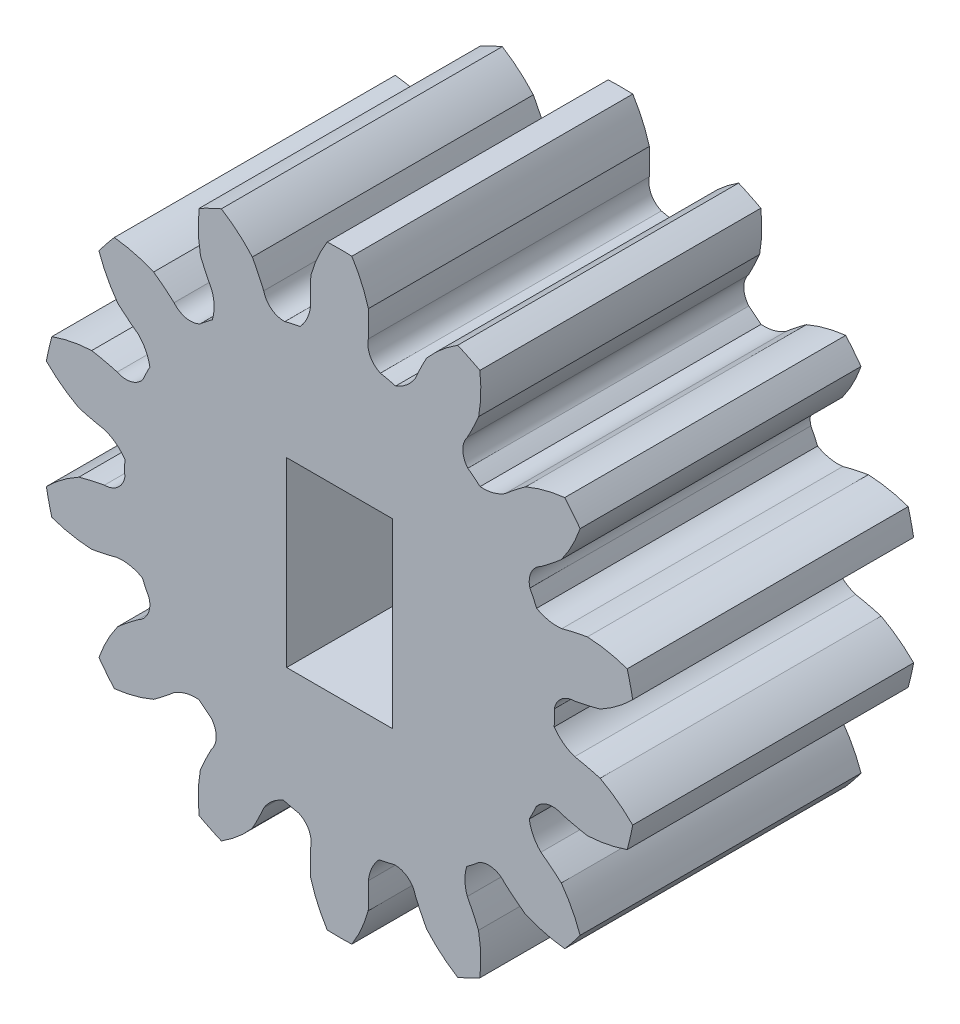
from build123d import *

# Parameters (mm, degrees)
BOSS_EXTRUDE1_DEPTH    = 8.5
BOSS_EXTRUDE1_2_DEPTH  = 8.5
BOSS_EXTRUDE1_3_DEPTH  = 8.5
BOSS_EXTRUDE1_4_DEPTH  = 8.5
BOSS_EXTRUDE1_5_DEPTH  = 8.5
BOSS_EXTRUDE1_6_DEPTH  = 8.5
BOSS_EXTRUDE1_7_DEPTH  = 8.5
BOSS_EXTRUDE1_8_DEPTH  = 8.5
BOSS_EXTRUDE1_9_DEPTH  = 8.5
BOSS_EXTRUDE1_10_DEPTH = 8.5
BOSS_EXTRUDE1_11_DEPTH = 8.5
BOSS_EXTRUDE1_12_DEPTH = 8.5
BOSS_EXTRUDE1_13_DEPTH = 8.5
BOSS_EXTRUDE1_14_DEPTH = 8.5
SKETCH1_R              = 6.5
BOSS_EXTRUDE2_DEPTH    = 8.5
SKETCH3_W              = 3.2
SKETCH3_H              = 5.5
CUT_EXTRUDE1_DEPTH     = 6


with BuildPart() as part:
    # Sketch2 → Boss-Extrude1 (new body)
    with BuildSketch(Plane.XY.offset(20)):
        with BuildLine():
            ThreePointArc((-0.372442837, 29.93778576), (0, 29.945381287), (0.372442837, 29.93778576))
            ThreePointArc((0.372442837, 29.93778576), (0.664207711, 29.394961978), (0.87300932, 28.815146242))
            ThreePointArc((0.87300932, 28.815146242), (0.882118298, 28.419135302), (0.87300932, 28.023124361))
            ThreePointArc((0.87300932, 28.023124361), (0.925832605, 27.599473266), (1.236429032, 27.306556197))
            ThreePointArc((1.236429032, 27.306556197), (0.022155909, 27.42519857), (-1.192897802, 27.314836852))
            ThreePointArc((-1.192897802, 27.314836852), (-0.97608072, 27.643294757), (-0.87300932, 28.023124361))
            ThreePointArc((-0.87300932, 28.023124361), (-0.8804421, 28.419198634), (-0.867969423, 28.815146242))
            ThreePointArc((-0.867969423, 28.815146242), (-0.661618034, 29.394744976), (-0.372442837, 29.93778576))
        make_face()
    extrude(amount=BOSS_EXTRUDE1_DEPTH)



with BuildPart() as body_2:
    # Sketch2 → Boss-Extrude1 2 (new body)
    with BuildSketch(Plane.XY.offset(20)):
        with BuildLine():
            ThreePointArc((1.697579984, 27.199646438), (2.840189705, 26.771886862), (3.882734989, 26.138140415))
            ThreePointArc((3.882734989, 26.138140415), (3.729989232, 26.536812314), (3.866212417, 26.941427926))
            ThreePointArc((3.866212417, 26.941427926), (4.04624203, 27.294269217), (4.209857833, 27.655014984))
            ThreePointArc((4.209857833, 27.655014984), (4.273306703, 28.268006533), (4.245958047, 28.883665896))
            ThreePointArc((4.245958047, 28.883665896), (3.913694222, 29.052106121), (3.574839244, 29.206859677))
            ThreePointArc((3.574839244, 29.206859677), (3.078684828, 28.843065253), (2.641290186, 28.41039735))
            ThreePointArc((2.641290186, 28.41039735), (2.458257463, 28.059072574), (2.29310398, 27.698997022))
            ThreePointArc((2.29310398, 27.698997022), (2.035437968, 27.401503378), (1.697579984, 27.199646438))
        make_face()
    extrude(amount=BOSS_EXTRUDE1_2_DEPTH)


with BuildPart() as body_3:
    # Sketch2 → Boss-Extrude1 3 (new body)
    with BuildSketch(Plane.XY.offset(20)):
        with BuildLine():
            ThreePointArc((4.251831235, 25.84173215), (5.095689097, 24.960574312), (5.760017664, 23.937245047))
            ThreePointArc((5.760017664, 23.937245047), (5.795375746, 24.362709917), (6.093664729, 24.668150961))
            ThreePointArc((6.093664729, 24.668150961), (6.408957905, 24.907938059), (6.712892371, 25.161968527))
            ThreePointArc((6.712892371, 25.161968527), (7.036024894, 25.686725397), (7.278509192, 26.253281452))
            ThreePointArc((7.278509192, 26.253281452), (7.052233304, 26.549204722), (6.81408057, 26.835656524))
            ThreePointArc((6.81408057, 26.835656524), (6.209216403, 26.723162406), (5.62740988, 26.523120518))
            ThreePointArc((5.62740988, 26.523120518), (5.310068987, 26.286002754), (5.005039914, 26.033243303))
            ThreePointArc((5.005039914, 26.033243303), (4.643813204, 25.877007884), (4.251831235, 25.84173215))
        make_face()
    extrude(amount=BOSS_EXTRUDE1_3_DEPTH)


with BuildPart() as body_4:
    # Sketch2 → Boss-Extrude1 4 (new body)
    with BuildSketch(Plane.XY.offset(20)):
        with BuildLine():
            ThreePointArc((5.963955164, 23.510045569), (6.341924769, 22.350013584), (6.496458198, 21.139784413))
            ThreePointArc((6.496458198, 21.139784413), (6.712917018, 21.507773718), (7.114192008, 21.65354385))
            ThreePointArc((7.114192008, 21.65354385), (7.502301066, 21.732783978), (7.886356247, 21.829785299))
            ThreePointArc((7.886356247, 21.829785299), (8.405172063, 22.162372954), (8.869462327, 22.567612329))
            ThreePointArc((8.869462327, 22.567612329), (8.793991091, 22.93240741), (8.703709671, 23.293822164))
            ThreePointArc((8.703709671, 23.293822164), (8.109936518, 23.454909193), (7.498952032, 23.52711407))
            ThreePointArc((7.498952032, 23.52711407), (7.110156225, 23.451167399), (6.725666309, 23.355786157))
            ThreePointArc((6.725666309, 23.355786157), (6.332424282, 23.371753304), (5.963955164, 23.510045569))
        make_face()
    extrude(amount=BOSS_EXTRUDE1_4_DEPTH)


with BuildPart() as body_5:
    # Sketch2 → Boss-Extrude1 5 (new body)
    with BuildSketch(Plane.XY.offset(20)):
        with BuildLine():
            ThreePointArc((6.49484463, 20.666405817), (6.332064462, 19.457258248), (5.946195512, 18.299829899))
            ThreePointArc((5.946195512, 18.299829899), (6.300882746, 18.537458845), (6.725666309, 18.494686503))
            ThreePointArc((6.725666309, 18.494686503), (7.109721491, 18.397685182), (7.497830549, 18.318445054))
            ThreePointArc((7.497830549, 18.318445054), (8.109571823, 18.392990431), (8.703709671, 18.556650496))
            ThreePointArc((8.703709671, 18.556650496), (8.793991091, 18.91806525), (8.869462327, 19.282860332))
            ThreePointArc((8.869462327, 19.282860332), (8.404384244, 19.685623245), (7.885234765, 20.015773825))
            ThreePointArc((7.885234765, 20.015773825), (7.501989821, 20.116040417), (7.114192008, 20.19692881))
            ThreePointArc((7.114192008, 20.19692881), (6.766821069, 20.381936033), (6.49484463, 20.666405817))
        make_face()
    extrude(amount=BOSS_EXTRUDE1_5_DEPTH)


with BuildPart() as body_6:
    # Sketch2 → Boss-Extrude1 6 (new body)
    with BuildSketch(Plane.XY.offset(20)):
        with BuildLine():
            ThreePointArc((5.739350463, 17.874030623), (5.06806113, 16.855253974), (4.21821588, 15.979869328))
            ThreePointArc((4.21821588, 15.979869328), (4.640881371, 16.040072587), (5.005039914, 15.817229357))
            ThreePointArc((5.005039914, 15.817229357), (5.30897438, 15.563198889), (5.624267555, 15.323411791))
            ThreePointArc((5.624267555, 15.323411791), (6.207771425, 15.125150264), (6.81408057, 15.014816136))
            ThreePointArc((6.81408057, 15.014816136), (7.052233304, 15.301267938), (7.278509192, 15.597191208))
            ThreePointArc((7.278509192, 15.597191208), (7.034240598, 16.161857871), (6.709750047, 16.684563783))
            ThreePointArc((6.709750047, 16.684563783), (6.407962328, 16.94118461), (6.093664729, 17.182321699))
            ThreePointArc((6.093664729, 17.182321699), (5.860965954, 17.499726049), (5.739350463, 17.874030623))
        make_face()
    extrude(amount=BOSS_EXTRUDE1_6_DEPTH)


with BuildPart() as body_7:
    # Sketch2 → Boss-Extrude1 7 (new body)
    with BuildSketch(Plane.XY.offset(20)):
        with BuildLine():
            ThreePointArc((3.847107548, 15.68598414), (2.800266136, 15.059359621), (1.65476686, 14.639399342))
            ThreePointArc((1.65476686, 14.639399342), (2.061696523, 14.510252921), (2.29310398, 14.151475639))
            ThreePointArc((2.29310398, 14.151475639), (2.456719782, 13.790729872), (2.636749396, 13.43788858))
            ThreePointArc((2.636749396, 13.43788858), (3.076445764, 13.006088276), (3.574839244, 12.643612983))
            ThreePointArc((3.574839244, 12.643612983), (3.913694222, 12.798366539), (4.245958047, 12.966806765))
            ThreePointArc((4.245958047, 12.966806765), (4.270879331, 13.58153802), (4.205317042, 14.193270947))
            ThreePointArc((4.205317042, 14.193270947), (4.044759307, 14.555419107), (3.866212417, 14.909044735))
            ThreePointArc((3.866212417, 14.909044735), (3.794274651, 15.295980387), (3.847107548, 15.68598414))
        make_face()
    extrude(amount=BOSS_EXTRUDE1_7_DEPTH)


with BuildPart() as body_8:
    # Sketch2 → Boss-Extrude1 8 (new body)
    with BuildSketch(Plane.XY.offset(20)):
        with BuildLine():
            ThreePointArc((1.192897802, 14.535635808), (-0.022155909, 14.425274091), (-1.236429032, 14.543916463))
            ThreePointArc((-1.236429032, 14.543916463), (-0.925832605, 14.250999394), (-0.87300932, 13.827348299))
            ThreePointArc((-0.87300932, 13.827348299), (-0.882118298, 13.431337359), (-0.87300932, 13.035326418))
            ThreePointArc((-0.87300932, 13.035326418), (-0.664207711, 12.455510682), (-0.372442837, 11.912686901))
            ThreePointArc((-0.372442837, 11.912686901), (0, 11.905091373), (0.372442837, 11.912686901))
            ThreePointArc((0.372442837, 11.912686901), (0.661618034, 12.455727684), (0.867969423, 13.035326418))
            ThreePointArc((0.867969423, 13.035326418), (0.8804421, 13.431274026), (0.87300932, 13.827348299))
            ThreePointArc((0.87300932, 13.827348299), (0.97608072, 14.207177903), (1.192897802, 14.535635808))
        make_face()
    extrude(amount=BOSS_EXTRUDE1_8_DEPTH)


with BuildPart() as body_9:
    # Sketch2 → Boss-Extrude1 9 (new body)
    with BuildSketch(Plane.XY.offset(20)):
        with BuildLine():
            ThreePointArc((-1.697579984, 14.650826223), (-2.840189705, 15.078585798), (-3.882734989, 15.712332245))
            ThreePointArc((-3.882734989, 15.712332245), (-3.729989232, 15.313660346), (-3.866212417, 14.909044735))
            ThreePointArc((-3.866212417, 14.909044735), (-4.04624203, 14.556203443), (-4.209857833, 14.195457676))
            ThreePointArc((-4.209857833, 14.195457676), (-4.273306703, 13.582466127), (-4.245958047, 12.966806765))
            ThreePointArc((-4.245958047, 12.966806765), (-3.913694222, 12.798366539), (-3.574839244, 12.643612983))
            ThreePointArc((-3.574839244, 12.643612983), (-3.078684828, 13.007407407), (-2.641290186, 13.44007531))
            ThreePointArc((-2.641290186, 13.44007531), (-2.458257463, 13.791400086), (-2.29310398, 14.151475639))
            ThreePointArc((-2.29310398, 14.151475639), (-2.035437968, 14.448969282), (-1.697579984, 14.650826223))
        make_face()
    extrude(amount=BOSS_EXTRUDE1_9_DEPTH)


with BuildPart() as body_10:
    # Sketch2 → Boss-Extrude1 10 (new body)
    with BuildSketch(Plane.XY.offset(20)):
        with BuildLine():
            ThreePointArc((-4.251831235, 16.00874051), (-5.095689097, 16.889898348), (-5.760017664, 17.913227613))
            ThreePointArc((-5.760017664, 17.913227613), (-5.795375746, 17.487762743), (-6.093664729, 17.182321699))
            ThreePointArc((-6.093664729, 17.182321699), (-6.408957905, 16.942534602), (-6.712892371, 16.688504133))
            ThreePointArc((-6.712892371, 16.688504133), (-7.036024894, 16.163747263), (-7.278509192, 15.597191208))
            ThreePointArc((-7.278509192, 15.597191208), (-7.052233304, 15.301267938), (-6.81408057, 15.014816136))
            ThreePointArc((-6.81408057, 15.014816136), (-6.209216403, 15.127310254), (-5.62740988, 15.327352142))
            ThreePointArc((-5.62740988, 15.327352142), (-5.310068987, 15.564469906), (-5.005039914, 15.817229357))
            ThreePointArc((-5.005039914, 15.817229357), (-4.643813204, 15.973464776), (-4.251831235, 16.00874051))
        make_face()
    extrude(amount=BOSS_EXTRUDE1_10_DEPTH)


with BuildPart() as body_11:
    # Sketch2 → Boss-Extrude1 11 (new body)
    with BuildSketch(Plane.XY.offset(20)):
        with BuildLine():
            ThreePointArc((-5.963955164, 18.340427091), (-6.341924769, 19.500459076), (-6.496458198, 20.710688248))
            ThreePointArc((-6.496458198, 20.710688248), (-6.712917018, 20.342698943), (-7.114192008, 20.19692881))
            ThreePointArc((-7.114192008, 20.19692881), (-7.502301066, 20.117688682), (-7.886356247, 20.020687361))
            ThreePointArc((-7.886356247, 20.020687361), (-8.405172063, 19.688099706), (-8.869462327, 19.282860332))
            ThreePointArc((-8.869462327, 19.282860332), (-8.793991091, 18.91806525), (-8.703709671, 18.556650496))
            ThreePointArc((-8.703709671, 18.556650496), (-8.109936518, 18.395563467), (-7.498952032, 18.323358591))
            ThreePointArc((-7.498952032, 18.323358591), (-7.110156225, 18.399305261), (-6.725666309, 18.494686503))
            ThreePointArc((-6.725666309, 18.494686503), (-6.332424282, 18.478719356), (-5.963955164, 18.340427091))
        make_face()
    extrude(amount=BOSS_EXTRUDE1_11_DEPTH)


with BuildPart() as body_12:
    # Sketch2 → Boss-Extrude1 12 (new body)
    with BuildSketch(Plane.XY.offset(20)):
        with BuildLine():
            ThreePointArc((-6.49484463, 21.184066843), (-6.332064462, 22.393214413), (-5.946195512, 23.550642761))
            ThreePointArc((-5.946195512, 23.550642761), (-6.300882746, 23.313013816), (-6.725666309, 23.355786157))
            ThreePointArc((-6.725666309, 23.355786157), (-7.109721491, 23.452787479), (-7.497830549, 23.532027606))
            ThreePointArc((-7.497830549, 23.532027606), (-8.109571823, 23.457482229), (-8.703709671, 23.293822164))
            ThreePointArc((-8.703709671, 23.293822164), (-8.793991091, 22.93240741), (-8.869462327, 22.567612329))
            ThreePointArc((-8.869462327, 22.567612329), (-8.404384244, 22.164849415), (-7.885234765, 21.834698836))
            ThreePointArc((-7.885234765, 21.834698836), (-7.501989821, 21.734432243), (-7.114192008, 21.65354385))
            ThreePointArc((-7.114192008, 21.65354385), (-6.766821069, 21.468536627), (-6.49484463, 21.184066843))
        make_face()
    extrude(amount=BOSS_EXTRUDE1_12_DEPTH)


with BuildPart() as body_13:
    # Sketch2 → Boss-Extrude1 13 (new body)
    with BuildSketch(Plane.XY.offset(20)):
        with BuildLine():
            ThreePointArc((-5.739350463, 23.976442037), (-5.06806113, 24.995218686), (-4.21821588, 25.870603333))
            ThreePointArc((-4.21821588, 25.870603333), (-4.640881371, 25.810400073), (-5.005039914, 26.033243303))
            ThreePointArc((-5.005039914, 26.033243303), (-5.30897438, 26.287273771), (-5.624267555, 26.527060869))
            ThreePointArc((-5.624267555, 26.527060869), (-6.207771425, 26.725322396), (-6.81408057, 26.835656524))
            ThreePointArc((-6.81408057, 26.835656524), (-7.052233304, 26.549204722), (-7.278509192, 26.253281452))
            ThreePointArc((-7.278509192, 26.253281452), (-7.034240598, 25.688614789), (-6.709750047, 25.165908878))
            ThreePointArc((-6.709750047, 25.165908878), (-6.407962328, 24.90928805), (-6.093664729, 24.668150961))
            ThreePointArc((-6.093664729, 24.668150961), (-5.860965954, 24.350746611), (-5.739350463, 23.976442037))
        make_face()
    extrude(amount=BOSS_EXTRUDE1_13_DEPTH)


with BuildPart() as body_14:
    # Sketch2 → Boss-Extrude1 14 (new body)
    with BuildSketch(Plane.XY.offset(20)):
        with BuildLine():
            ThreePointArc((-3.847107548, 26.16448852), (-2.800266136, 26.791113039), (-1.65476686, 27.211073318))
            ThreePointArc((-1.65476686, 27.211073318), (-2.061696523, 27.340219739), (-2.29310398, 27.698997022))
            ThreePointArc((-2.29310398, 27.698997022), (-2.456719782, 28.059742788), (-2.636749396, 28.41258408))
            ThreePointArc((-2.636749396, 28.41258408), (-3.076445764, 28.844384384), (-3.574839244, 29.206859677))
            ThreePointArc((-3.574839244, 29.206859677), (-3.913694222, 29.052106121), (-4.245958047, 28.883665896))
            ThreePointArc((-4.245958047, 28.883665896), (-4.270879331, 28.26893464), (-4.205317042, 27.657201713))
            ThreePointArc((-4.205317042, 27.657201713), (-4.044759307, 27.295053553), (-3.866212417, 26.941427926))
            ThreePointArc((-3.866212417, 26.941427926), (-3.794274651, 26.554492273), (-3.847107548, 26.16448852))
        make_face()
    extrude(amount=BOSS_EXTRUDE1_14_DEPTH)


with BuildPart() as part_1:
    add(part.part)

    add(body_2.part)  # Boss-Extrude2 merges body 2

    add(body_3.part)  # Boss-Extrude2 merges body 3

    add(body_4.part)  # Boss-Extrude2 merges body 4

    add(body_5.part)  # Boss-Extrude2 merges body 5

    add(body_6.part)  # Boss-Extrude2 merges body 6

    add(body_7.part)  # Boss-Extrude2 merges body 7

    add(body_8.part)  # Boss-Extrude2 merges body 8

    add(body_9.part)  # Boss-Extrude2 merges body 9

    add(body_10.part)  # Boss-Extrude2 merges body 10

    add(body_11.part)  # Boss-Extrude2 merges body 11

    add(body_12.part)  # Boss-Extrude2 merges body 12

    add(body_13.part)  # Boss-Extrude2 merges body 13

    add(body_14.part)  # Boss-Extrude2 merges body 14
    # Sketch1 → Boss-Extrude2 (add)
    with BuildSketch(Plane.XY.offset(20)):
        with Locations((0, 20.92523633)):
            Circle(SKETCH1_R)
    extrude(amount=BOSS_EXTRUDE2_DEPTH)

    # Sketch3 → Cut-Extrude1 (cut)
    with BuildSketch(Plane.XY.offset(28.5)):
        with Locations((0, 20.92523633)):
            Rectangle(SKETCH3_W, SKETCH3_H)
    extrude(amount=-CUT_EXTRUDE1_DEPTH, mode=Mode.SUBTRACT)


solid = part_1.part
